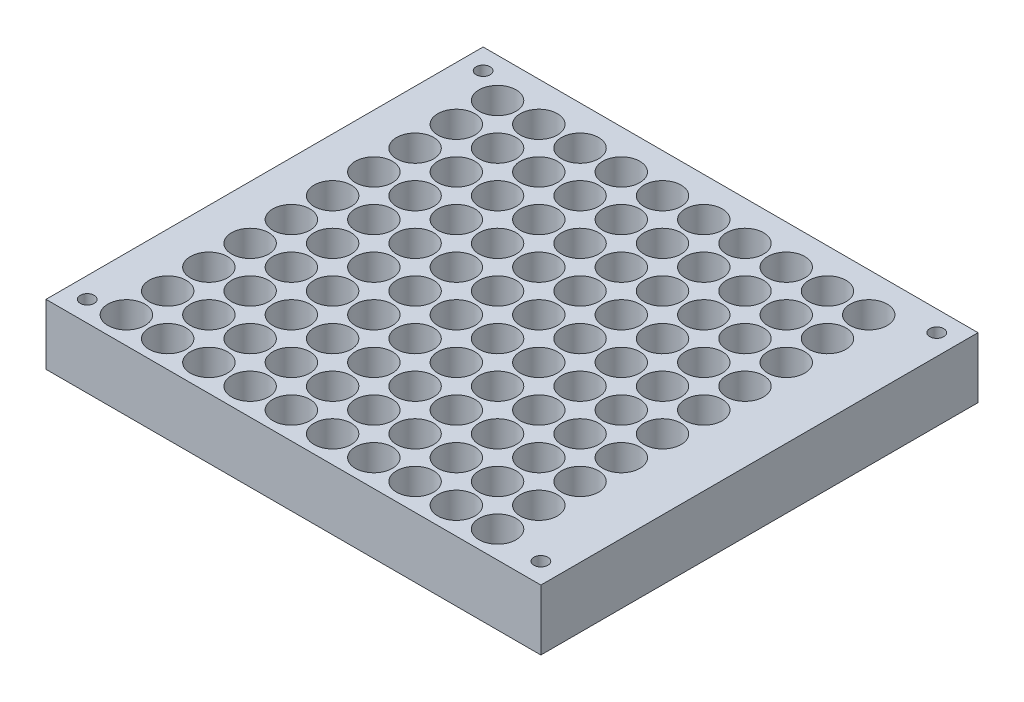
from build123d import *

# Parameters (mm, degrees)
SKETCH1_W           = 120
SKETCH1_H           = 106
SKETCH1_R           = 4.5
SKETCH1_R_2         = 1.7
BOSS_EXTRUDE1_DEPTH = 14.7


with BuildPart() as part:
    # Sketch1 → Boss-Extrude1 (new body)
    with BuildSketch(Plane(origin=(0, 0, 0), x_dir=(1, 0, 0), z_dir=(0, 1, 0))):
        with Locations((60, 53)):
            Rectangle(SKETCH1_W, SKETCH1_H)
        with Locations(Location((13, 36.5, 0), (0, 0, 270))):
            Circle(SKETCH1_R, mode=Mode.SUBTRACT)
        with Locations(Location((23, 36.5, 0), (0, 0, 270))):
            Circle(SKETCH1_R, mode=Mode.SUBTRACT)
        with Locations(Location((13, 6.5, 0), (0, 0, 270))):
            Circle(SKETCH1_R, mode=Mode.SUBTRACT)
        with Locations(Location((5, 5, 0), (0, 0, 270))):
            Circle(SKETCH1_R_2, mode=Mode.SUBTRACT)
        with Locations(Location((5, 101, 0), (0, 0, 270))):
            Circle(SKETCH1_R_2, mode=Mode.SUBTRACT)
        with Locations(Location((115, 101, 0), (0, 0, 270))):
            Circle(SKETCH1_R_2, mode=Mode.SUBTRACT)
        with Locations(Location((115, 5, 0), (0, 0, 270))):
            Circle(SKETCH1_R_2, mode=Mode.SUBTRACT)
        with Locations(Location((23, 6.5, 0), (0, 0, 270))):
            Circle(SKETCH1_R, mode=Mode.SUBTRACT)
        with Locations(Location((33, 6.5, 0), (0, 0, 270))):
            Circle(SKETCH1_R, mode=Mode.SUBTRACT)
        with Locations(Location((23, 16.5, 0), (0, 0, 270))):
            Circle(SKETCH1_R, mode=Mode.SUBTRACT)
        with Locations(Location((33, 16.5, 0), (0, 0, 270))):
            Circle(SKETCH1_R, mode=Mode.SUBTRACT)
        with Locations(Location((23, 26.5, 0), (0, 0, 270))):
            Circle(SKETCH1_R, mode=Mode.SUBTRACT)
        with Locations(Location((33, 26.5, 0), (0, 0, 270))):
            Circle(SKETCH1_R, mode=Mode.SUBTRACT)
        with Locations(Location((13, 16.5, 0), (0, 0, 270))):
            Circle(SKETCH1_R, mode=Mode.SUBTRACT)
        with Locations(Location((13, 26.5, 0), (0, 0, 270))):
            Circle(SKETCH1_R, mode=Mode.SUBTRACT)
        with Locations(Location((33, 36.5, 0), (0, 0, 270))):
            Circle(SKETCH1_R, mode=Mode.SUBTRACT)
        with Locations(Location((13, 46.5, 0), (0, 0, 270))):
            Circle(SKETCH1_R, mode=Mode.SUBTRACT)
        with Locations(Location((23, 46.5, 0), (0, 0, 270))):
            Circle(SKETCH1_R, mode=Mode.SUBTRACT)
        with Locations(Location((33, 46.5, 0), (0, 0, 270))):
            Circle(SKETCH1_R, mode=Mode.SUBTRACT)
        with Locations(Location((13, 56.5, 0), (0, 0, 270))):
            Circle(SKETCH1_R, mode=Mode.SUBTRACT)
        with Locations(Location((23, 56.5, 0), (0, 0, 270))):
            Circle(SKETCH1_R, mode=Mode.SUBTRACT)
        with Locations(Location((33, 56.5, 0), (0, 0, 270))):
            Circle(SKETCH1_R, mode=Mode.SUBTRACT)
        with Locations(Location((13, 66.5, 0), (0, 0, 270))):
            Circle(SKETCH1_R, mode=Mode.SUBTRACT)
        with Locations(Location((23, 66.5, 0), (0, 0, 270))):
            Circle(SKETCH1_R, mode=Mode.SUBTRACT)
        with Locations(Location((33, 66.5, 0), (0, 0, 270))):
            Circle(SKETCH1_R, mode=Mode.SUBTRACT)
        with Locations(Location((13, 76.5, 0), (0, 0, 270))):
            Circle(SKETCH1_R, mode=Mode.SUBTRACT)
        with Locations(Location((23, 76.5, 0), (0, 0, 270))):
            Circle(SKETCH1_R, mode=Mode.SUBTRACT)
        with Locations(Location((33, 76.5, 0), (0, 0, 270))):
            Circle(SKETCH1_R, mode=Mode.SUBTRACT)
        with Locations(Location((13, 86.5, 0), (0, 0, 270))):
            Circle(SKETCH1_R, mode=Mode.SUBTRACT)
        with Locations(Location((23, 86.5, 0), (0, 0, 270))):
            Circle(SKETCH1_R, mode=Mode.SUBTRACT)
        with Locations(Location((33, 86.5, 0), (0, 0, 270))):
            Circle(SKETCH1_R, mode=Mode.SUBTRACT)
        with Locations(Location((13, 96.5, 0), (0, 0, 270))):
            Circle(SKETCH1_R, mode=Mode.SUBTRACT)
        with Locations(Location((23, 96.5, 0), (0, 0, 270))):
            Circle(SKETCH1_R, mode=Mode.SUBTRACT)
        with Locations(Location((33, 96.5, 0), (0, 0, 270))):
            Circle(SKETCH1_R, mode=Mode.SUBTRACT)
        with Locations(Location((43, 6.5, 0), (0, 0, 270))):
            Circle(SKETCH1_R, mode=Mode.SUBTRACT)
        with Locations(Location((53, 6.5, 0), (0, 0, 270))):
            Circle(SKETCH1_R, mode=Mode.SUBTRACT)
        with Locations(Location((63, 6.5, 0), (0, 0, 270))):
            Circle(SKETCH1_R, mode=Mode.SUBTRACT)
        with Locations(Location((73, 6.5, 0), (0, 0, 270))):
            Circle(SKETCH1_R, mode=Mode.SUBTRACT)
        with Locations(Location((83, 6.5, 0), (0, 0, 270))):
            Circle(SKETCH1_R, mode=Mode.SUBTRACT)
        with Locations(Location((93, 6.5, 0), (0, 0, 270))):
            Circle(SKETCH1_R, mode=Mode.SUBTRACT)
        with Locations(Location((103, 6.5, 0), (0, 0, 270))):
            Circle(SKETCH1_R, mode=Mode.SUBTRACT)
        with Locations(Location((43, 16.5, 0), (0, 0, 270))):
            Circle(SKETCH1_R, mode=Mode.SUBTRACT)
        with Locations(Location((53, 16.5, 0), (0, 0, 270))):
            Circle(SKETCH1_R, mode=Mode.SUBTRACT)
        with Locations(Location((63, 16.5, 0), (0, 0, 270))):
            Circle(SKETCH1_R, mode=Mode.SUBTRACT)
        with Locations(Location((73, 16.5, 0), (0, 0, 270))):
            Circle(SKETCH1_R, mode=Mode.SUBTRACT)
        with Locations(Location((83, 16.5, 0), (0, 0, 270))):
            Circle(SKETCH1_R, mode=Mode.SUBTRACT)
        with Locations(Location((93, 16.5, 0), (0, 0, 270))):
            Circle(SKETCH1_R, mode=Mode.SUBTRACT)
        with Locations(Location((103, 16.5, 0), (0, 0, 270))):
            Circle(SKETCH1_R, mode=Mode.SUBTRACT)
        with Locations(Location((43, 26.5, 0), (0, 0, 270))):
            Circle(SKETCH1_R, mode=Mode.SUBTRACT)
        with Locations(Location((53, 26.5, 0), (0, 0, 270))):
            Circle(SKETCH1_R, mode=Mode.SUBTRACT)
        with Locations(Location((63, 26.5, 0), (0, 0, 270))):
            Circle(SKETCH1_R, mode=Mode.SUBTRACT)
        with Locations(Location((73, 26.5, 0), (0, 0, 270))):
            Circle(SKETCH1_R, mode=Mode.SUBTRACT)
        with Locations(Location((83, 26.5, 0), (0, 0, 270))):
            Circle(SKETCH1_R, mode=Mode.SUBTRACT)
        with Locations(Location((93, 26.5, 0), (0, 0, 270))):
            Circle(SKETCH1_R, mode=Mode.SUBTRACT)
        with Locations(Location((103, 26.5, 0), (0, 0, 270))):
            Circle(SKETCH1_R, mode=Mode.SUBTRACT)
        with Locations(Location((43, 36.5, 0), (0, 0, 270))):
            Circle(SKETCH1_R, mode=Mode.SUBTRACT)
        with Locations(Location((53, 36.5, 0), (0, 0, 270))):
            Circle(SKETCH1_R, mode=Mode.SUBTRACT)
        with Locations(Location((63, 36.5, 0), (0, 0, 270))):
            Circle(SKETCH1_R, mode=Mode.SUBTRACT)
        with Locations(Location((73, 36.5, 0), (0, 0, 270))):
            Circle(SKETCH1_R, mode=Mode.SUBTRACT)
        with Locations(Location((83, 36.5, 0), (0, 0, 270))):
            Circle(SKETCH1_R, mode=Mode.SUBTRACT)
        with Locations(Location((93, 36.5, 0), (0, 0, 270))):
            Circle(SKETCH1_R, mode=Mode.SUBTRACT)
        with Locations(Location((103, 36.5, 0), (0, 0, 270))):
            Circle(SKETCH1_R, mode=Mode.SUBTRACT)
        with Locations(Location((43, 46.5, 0), (0, 0, 270))):
            Circle(SKETCH1_R, mode=Mode.SUBTRACT)
        with Locations(Location((53, 46.5, 0), (0, 0, 270))):
            Circle(SKETCH1_R, mode=Mode.SUBTRACT)
        with Locations(Location((63, 46.5, 0), (0, 0, 270))):
            Circle(SKETCH1_R, mode=Mode.SUBTRACT)
        with Locations(Location((73, 46.5, 0), (0, 0, 270))):
            Circle(SKETCH1_R, mode=Mode.SUBTRACT)
        with Locations(Location((83, 46.5, 0), (0, 0, 270))):
            Circle(SKETCH1_R, mode=Mode.SUBTRACT)
        with Locations(Location((93, 46.5, 0), (0, 0, 270))):
            Circle(SKETCH1_R, mode=Mode.SUBTRACT)
        with Locations(Location((103, 46.5, 0), (0, 0, 270))):
            Circle(SKETCH1_R, mode=Mode.SUBTRACT)
        with Locations(Location((43, 56.5, 0), (0, 0, 270))):
            Circle(SKETCH1_R, mode=Mode.SUBTRACT)
        with Locations(Location((53, 56.5, 0), (0, 0, 270))):
            Circle(SKETCH1_R, mode=Mode.SUBTRACT)
        with Locations(Location((63, 56.5, 0), (0, 0, 270))):
            Circle(SKETCH1_R, mode=Mode.SUBTRACT)
        with Locations(Location((73, 56.5, 0), (0, 0, 270))):
            Circle(SKETCH1_R, mode=Mode.SUBTRACT)
        with Locations(Location((83, 56.5, 0), (0, 0, 270))):
            Circle(SKETCH1_R, mode=Mode.SUBTRACT)
        with Locations(Location((93, 56.5, 0), (0, 0, 270))):
            Circle(SKETCH1_R, mode=Mode.SUBTRACT)
        with Locations(Location((103, 56.5, 0), (0, 0, 270))):
            Circle(SKETCH1_R, mode=Mode.SUBTRACT)
        with Locations(Location((43, 66.5, 0), (0, 0, 270))):
            Circle(SKETCH1_R, mode=Mode.SUBTRACT)
        with Locations(Location((53, 66.5, 0), (0, 0, 270))):
            Circle(SKETCH1_R, mode=Mode.SUBTRACT)
        with Locations(Location((63, 66.5, 0), (0, 0, 270))):
            Circle(SKETCH1_R, mode=Mode.SUBTRACT)
        with Locations(Location((73, 66.5, 0), (0, 0, 270))):
            Circle(SKETCH1_R, mode=Mode.SUBTRACT)
        with Locations(Location((83, 66.5, 0), (0, 0, 270))):
            Circle(SKETCH1_R, mode=Mode.SUBTRACT)
        with Locations(Location((93, 66.5, 0), (0, 0, 270))):
            Circle(SKETCH1_R, mode=Mode.SUBTRACT)
        with Locations(Location((103, 66.5, 0), (0, 0, 270))):
            Circle(SKETCH1_R, mode=Mode.SUBTRACT)
        with Locations(Location((43, 76.5, 0), (0, 0, 270))):
            Circle(SKETCH1_R, mode=Mode.SUBTRACT)
        with Locations(Location((53, 76.5, 0), (0, 0, 270))):
            Circle(SKETCH1_R, mode=Mode.SUBTRACT)
        with Locations(Location((63, 76.5, 0), (0, 0, 270))):
            Circle(SKETCH1_R, mode=Mode.SUBTRACT)
        with Locations(Location((73, 76.5, 0), (0, 0, 270))):
            Circle(SKETCH1_R, mode=Mode.SUBTRACT)
        with Locations(Location((83, 76.5, 0), (0, 0, 270))):
            Circle(SKETCH1_R, mode=Mode.SUBTRACT)
        with Locations(Location((93, 76.5, 0), (0, 0, 270))):
            Circle(SKETCH1_R, mode=Mode.SUBTRACT)
        with Locations(Location((103, 76.5, 0), (0, 0, 270))):
            Circle(SKETCH1_R, mode=Mode.SUBTRACT)
        with Locations(Location((43, 86.5, 0), (0, 0, 270))):
            Circle(SKETCH1_R, mode=Mode.SUBTRACT)
        with Locations(Location((53, 86.5, 0), (0, 0, 270))):
            Circle(SKETCH1_R, mode=Mode.SUBTRACT)
        with Locations(Location((63, 86.5, 0), (0, 0, 270))):
            Circle(SKETCH1_R, mode=Mode.SUBTRACT)
        with Locations(Location((73, 86.5, 0), (0, 0, 270))):
            Circle(SKETCH1_R, mode=Mode.SUBTRACT)
        with Locations(Location((83, 86.5, 0), (0, 0, 270))):
            Circle(SKETCH1_R, mode=Mode.SUBTRACT)
        with Locations(Location((93, 86.5, 0), (0, 0, 270))):
            Circle(SKETCH1_R, mode=Mode.SUBTRACT)
        with Locations(Location((103, 86.5, 0), (0, 0, 270))):
            Circle(SKETCH1_R, mode=Mode.SUBTRACT)
        with Locations(Location((43, 96.5, 0), (0, 0, 270))):
            Circle(SKETCH1_R, mode=Mode.SUBTRACT)
        with Locations(Location((53, 96.5, 0), (0, 0, 270))):
            Circle(SKETCH1_R, mode=Mode.SUBTRACT)
        with Locations(Location((63, 96.5, 0), (0, 0, 270))):
            Circle(SKETCH1_R, mode=Mode.SUBTRACT)
        with Locations(Location((73, 96.5, 0), (0, 0, 270))):
            Circle(SKETCH1_R, mode=Mode.SUBTRACT)
        with Locations(Location((83, 96.5, 0), (0, 0, 270))):
            Circle(SKETCH1_R, mode=Mode.SUBTRACT)
        with Locations(Location((93, 96.5, 0), (0, 0, 270))):
            Circle(SKETCH1_R, mode=Mode.SUBTRACT)
        with Locations(Location((103, 96.5, 0), (0, 0, 270))):
            Circle(SKETCH1_R, mode=Mode.SUBTRACT)
    extrude(amount=BOSS_EXTRUDE1_DEPTH)


solid = part.part
